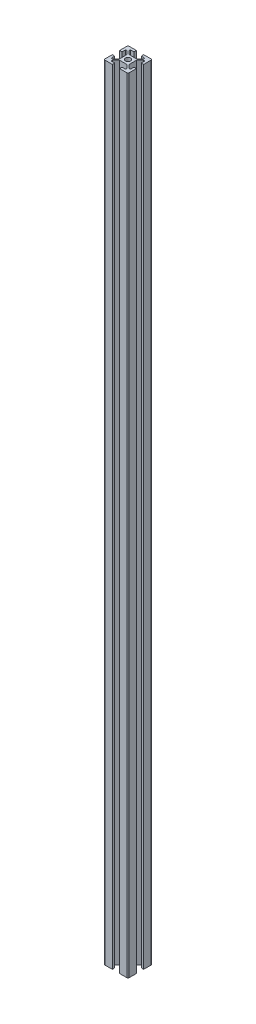
from build123d import *

# Parameters (mm, degrees)
SKETCH1_W           = 8
SKETCH1_H           = 8
SKETCH1_R           = 2.1
BOSS_EXTRUDE1_DEPTH = 650
FILLET1_R           = 1


with BuildPart() as part:
    # Sketch1 → Boss-Extrude1 (new body)
    # profile 1 of 6: a face of its own
    with BuildSketch(Plane(origin=(0, 0, 0), x_dir=(1, 0, 0), z_dir=(0, 1, 0))):
        Polygon((-4, 4), (-10, 10), (-10, 3), (-8, 3), (-8, 6), (-7, 6), (-4, 3), align=None)
    # profile 2 of 6: a face of its own
    with BuildSketch(Plane(origin=(0, 0, 0), x_dir=(1, 0, 0), z_dir=(0, 1, 0))):
        Polygon((-3, 8), (-3, 10), (-10, 10), (-4, 4), (-3, 4), (-6, 7), (-6, 8), align=None)
    # profile 3 of 6: a face of its own
    with BuildSketch(Plane(origin=(0, 0, 0), x_dir=(1, 0, 0), z_dir=(0, 1, 0))):
        Polygon((6, 7), (3, 4), (4, 4), (4, 3), (7, 6), (8, 6), (8, 3), (10, 3), (10, 10), (3, 10), (3, 8), (6, 8), align=None)
    # profile 4 of 6: a face of its own
    with BuildSketch(Plane(origin=(0, 0, 0), x_dir=(1, 0, 0), z_dir=(0, 1, 0))):
        Rectangle(SKETCH1_W, SKETCH1_H)
        with Locations(Location((0, 0, 0), (0, 0, 270))):
            Circle(SKETCH1_R, mode=Mode.SUBTRACT)
    # profile 5 of 6: a face of its own
    with BuildSketch(Plane(origin=(0, 0, 0), x_dir=(1, 0, 0), z_dir=(0, 1, 0))):
        Polygon((4, -4), (3, -4), (6, -7), (6, -8), (3, -8), (3, -10), (10, -10), (10, -3), (8, -3), (8, -6), (7, -6), (4, -3), align=None)
    # profile 6 of 6: a face of its own
    with BuildSketch(Plane(origin=(0, 0, 0), x_dir=(1, 0, 0), z_dir=(0, 1, 0))):
        Polygon((-4, -4), (-4, -3), (-7, -6), (-8, -6), (-8, -3), (-10, -3), (-10, -10), (-3, -10), (-3, -8), (-6, -8), (-6, -7), (-3, -4), align=None)
    extrude(amount=BOSS_EXTRUDE1_DEPTH)

    # Fillet1
    fillet1_edges = [part.edges().sort_by_distance(p)[0] for p in [
        (-10, 325, 10),
        (-10, 325, -10),
        (10, 325, -10),
        (10, 325, 10),
    ]]
    fillet(fillet1_edges, radius=FILLET1_R)


solid = part.part
